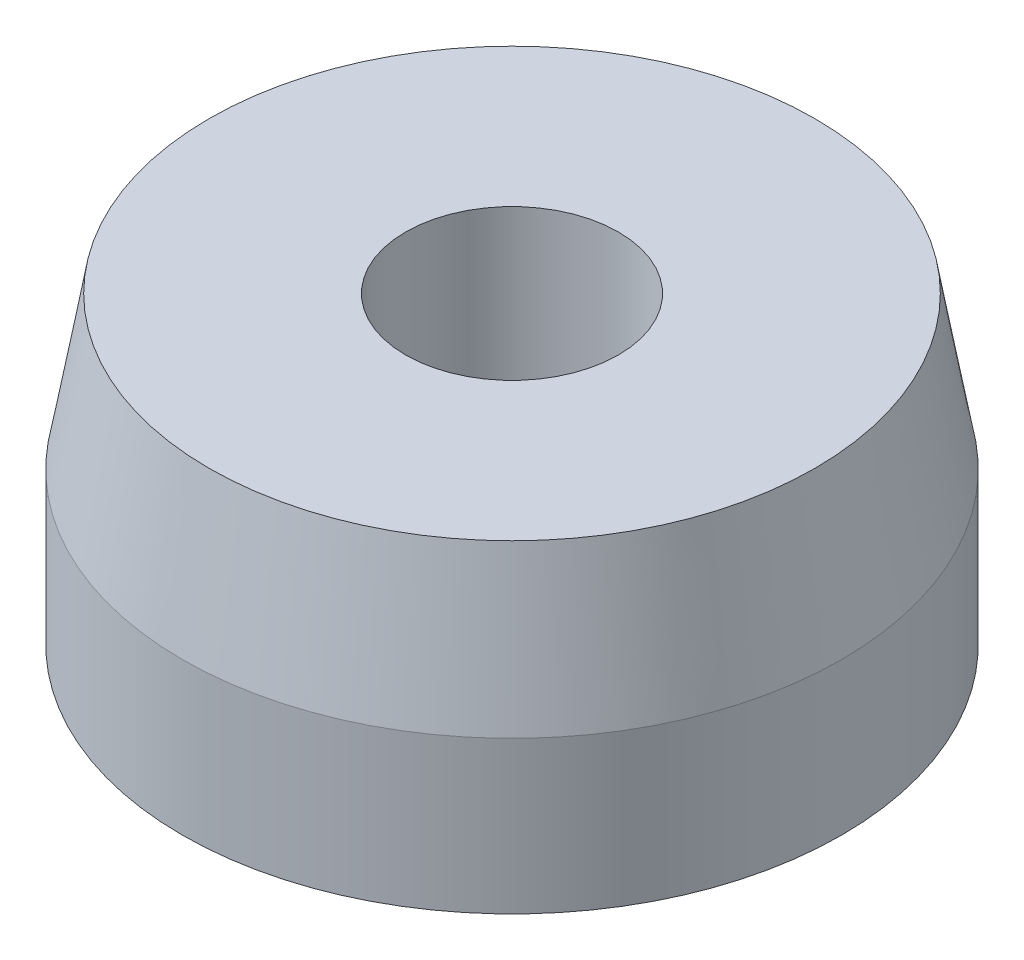
from build123d import *

# Parameters (mm, degrees)
SKETCH1_R           = 10.837
SKETCH1_R_2         = 3.5
BOSS_EXTRUDE1_DEPTH = 10
CHAMFER1_SIZE       = 5
CHAMFER1_SIZE2      = 0.881634904


with BuildPart() as part:
    # Sketch1 → Boss-Extrude1 (new body)
    with BuildSketch(Plane(origin=(0, 0, 0), x_dir=(1, 0, 0), z_dir=(0, 1, 0))):
        with Locations(Location((0, 0, 0), (0, 0, 270))):
            Circle(SKETCH1_R)
        with Locations(Location((0, 0, 0), (0, 0, 270))):
            Circle(SKETCH1_R_2, mode=Mode.SUBTRACT)
    extrude(amount=BOSS_EXTRUDE1_DEPTH)

    # Chamfer1
    chamfer1_edges = [part.edges().sort_by_distance(p)[0] for p in [
        (0, 10, -10.837),
    ]]
    chamfer1_side = [part.faces().sort_by_distance(p)[0] for p in [
        (0, 5, -10.837),
    ]]
    chamfer(chamfer1_edges, length=CHAMFER1_SIZE, length2=CHAMFER1_SIZE2, reference=chamfer1_side[0])


solid = part.part
